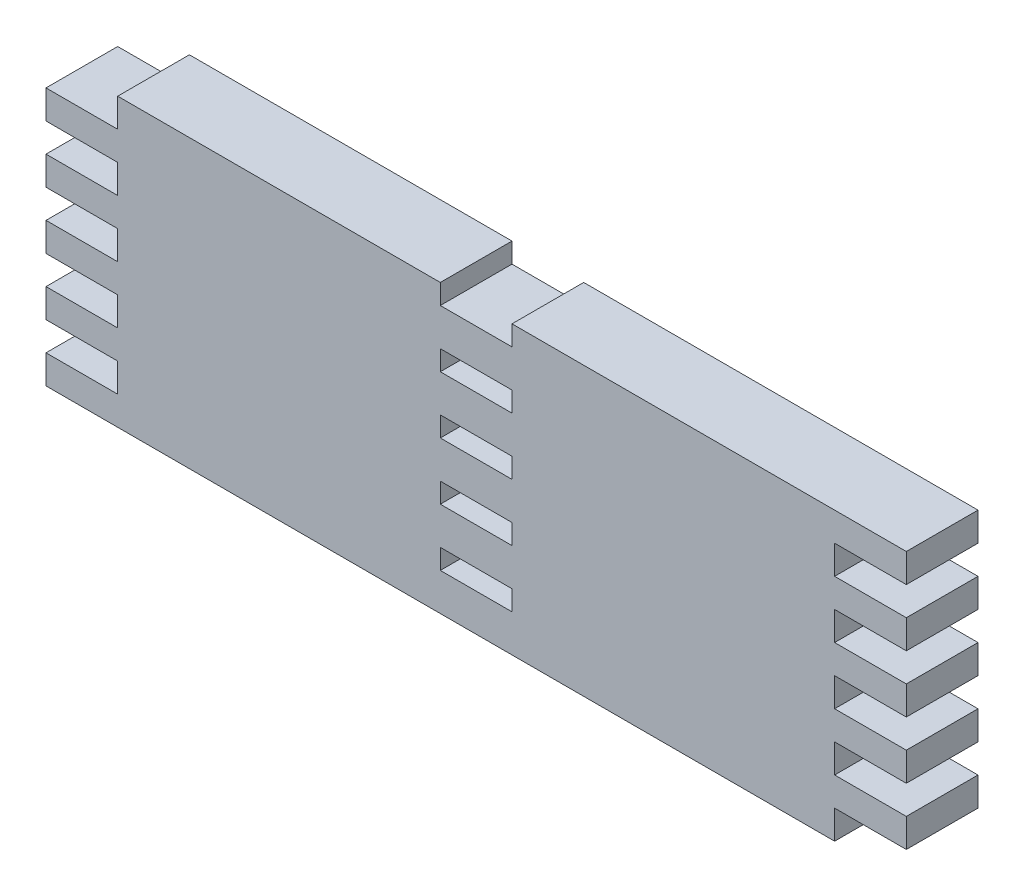
from build123d import *

# Parameters (mm, degrees)
SKETCH1_W           = 60
SKETCH1_H           = 20
BOSS_EXTRUDE1_DEPTH = 2.5
SKETCH2_W           = 5
SKETCH2_H           = 2
CUT_EXTRUDE1_DEPTH  = 33.015621187
SKETCH3_W           = 5
SKETCH3_H           = 2
CUT_EXTRUDE2_DEPTH  = 5
SKETCH4_W           = 5
SKETCH4_H           = 1.394303276
CUT_EXTRUDE3_DEPTH  = 5


with BuildPart() as part:
    # Sketch1 → Boss-Extrude1 (new, symmetric)
    with BuildSketch(Plane.XY):
        Rectangle(SKETCH1_W, SKETCH1_H)
    extrude(amount=BOSS_EXTRUDE1_DEPTH, both=True)

    # Sketch2 → Cut-Extrude1 (cut, through all)
    with BuildSketch(Plane.XY.offset(2.5)):
        with Locations((-27.5, 5)):
            Rectangle(SKETCH2_W, SKETCH2_H)
        with Locations((-27.5, 9)):
            Rectangle(SKETCH2_W, SKETCH2_H)
        with Locations((-27.5, 1)):
            Rectangle(SKETCH2_W, SKETCH2_H)
        with Locations((-27.5, -3)):
            Rectangle(SKETCH2_W, SKETCH2_H)
        with Locations((-27.5, -7)):
            Rectangle(SKETCH2_W, SKETCH2_H)
    extrude(amount=-CUT_EXTRUDE1_DEPTH, mode=Mode.SUBTRACT)

    # Sketch3 → Cut-Extrude2 (cut)
    with BuildSketch(Plane.XY.offset(2.5)):
        with Locations((27.5, -9)):
            Rectangle(SKETCH3_W, SKETCH3_H)
        with Locations((27.5, -5)):
            Rectangle(SKETCH3_W, SKETCH3_H)
        with Locations((27.5, -1)):
            Rectangle(SKETCH3_W, SKETCH3_H)
        with Locations((27.5, 3)):
            Rectangle(SKETCH3_W, SKETCH3_H)
        with Locations((27.5, 7)):
            Rectangle(SKETCH3_W, SKETCH3_H)
    extrude(amount=-CUT_EXTRUDE2_DEPTH, mode=Mode.SUBTRACT)

    # Sketch4 → Cut-Extrude3 (cut)
    with BuildSketch(Plane.XY.offset(2.5)):
        with Locations((0, 9.302848362)):
            Rectangle(SKETCH4_W, SKETCH4_H)
        with Locations((0, 5.302848362)):
            Rectangle(SKETCH4_W, SKETCH4_H)
        with Locations((0, 1.302848362)):
            Rectangle(SKETCH4_W, SKETCH4_H)
        with Locations((0, -2.697151638)):
            Rectangle(SKETCH4_W, SKETCH4_H)
        with Locations((0, -6.697151638)):
            Rectangle(SKETCH4_W, SKETCH4_H)
    extrude(amount=-CUT_EXTRUDE3_DEPTH, mode=Mode.SUBTRACT)


solid = part.part
